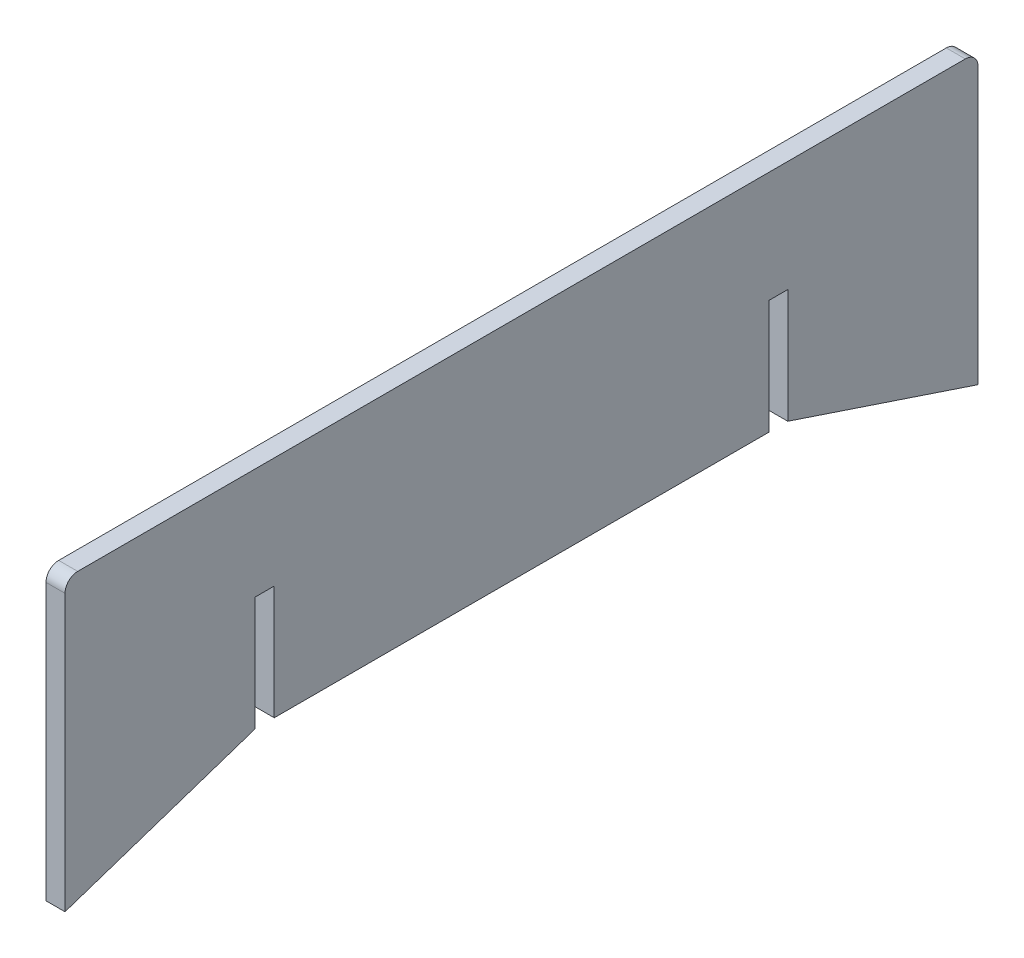
from build123d import *

# Parameters (mm, degrees)
SKETCH1_W           = 144
SKETCH1_H           = 35.5
BOSS_EXTRUDE1_DEPTH = 3
FILLET1_R           = 2
SKETCH2_W           = 3
SKETCH2_H           = 18
CUT_EXTRUDE1_DEPTH  = 3
BOSS_EXTRUDE2_DEPTH = 3


with BuildPart() as part:
    # Sketch1 → Boss-Extrude1 (new body)
    with BuildSketch(Plane(origin=(0, 0, 0), x_dir=(0, 0, -1), z_dir=(1, 0, 0))):
        Rectangle(SKETCH1_W, SKETCH1_H)
    extrude(amount=BOSS_EXTRUDE1_DEPTH)

    # Fillet1
    fillet1_edges = [part.edges().sort_by_distance(p)[0] for p in [
        (1.5, 17.75, 72),
        (1.5, 17.75, -72),
    ]]
    fillet(fillet1_edges, radius=FILLET1_R)

    # Sketch2 → Cut-Extrude1 (cut)
    with BuildSketch(Plane(origin=(3, 0, 0), x_dir=(0, 0, -1), z_dir=(1, 0, 0))):
        with Locations((-40.5, -8.75)):
            Rectangle(SKETCH2_W, SKETCH2_H)
        with Locations((40.5, -8.75)):
            Rectangle(SKETCH2_W, SKETCH2_H)
    extrude(amount=-CUT_EXTRUDE1_DEPTH, mode=Mode.SUBTRACT)

    # Sketch3 → Boss-Extrude2 (add)
    with BuildSketch(Plane(origin=(3, 0, 0), x_dir=(0, 0, -1), z_dir=(1, 0, 0))):
        Polygon((-72, -17.75), (-72, -27.75), (-42, -17.75), align=None)
    boss_extrude2 = extrude(amount=-BOSS_EXTRUDE2_DEPTH)

    # Mirror1: Boss-Extrude2 across plane
    add(boss_extrude2.mirror(Plane.XY))


solid = part.part
